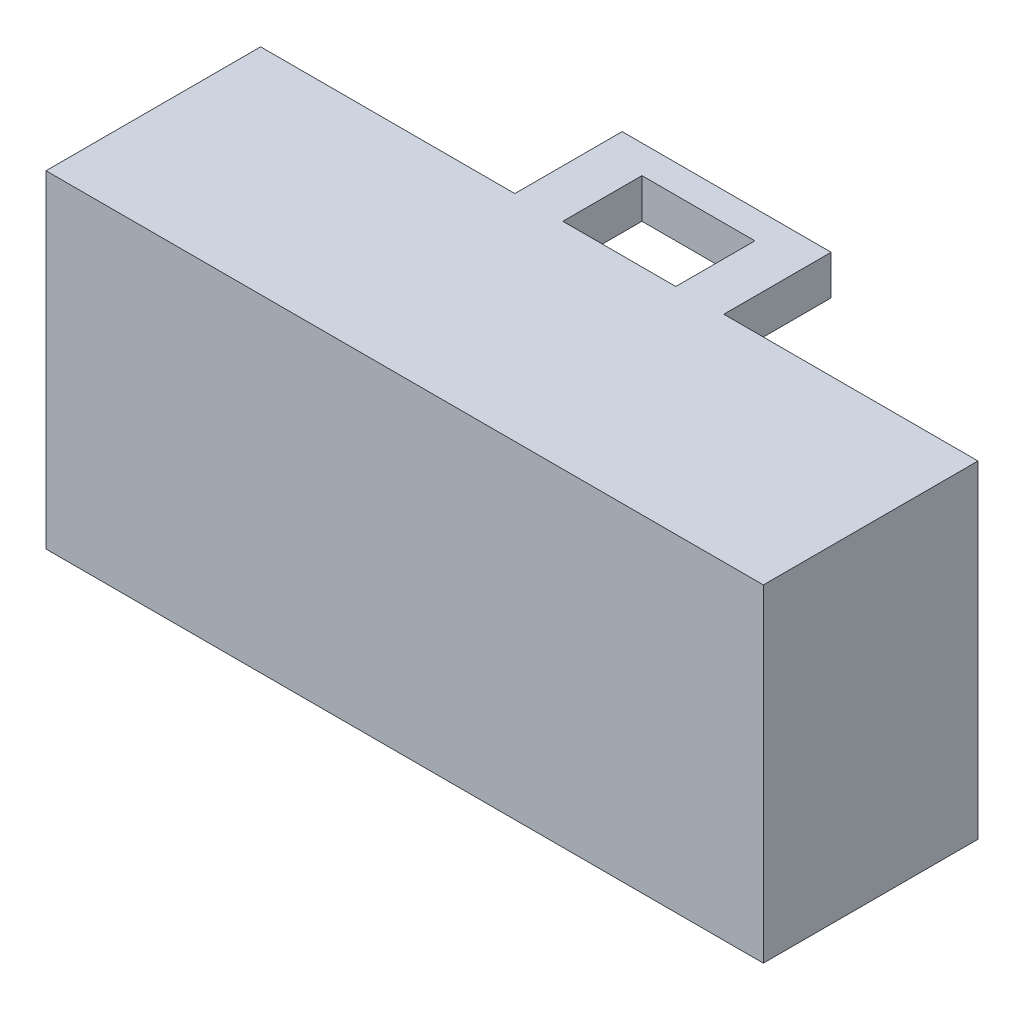
from build123d import *

# Parameters (mm, degrees)
CROQUIS1_W              = 12.7
CROQUIS1_H              = 5.8
SALIENTE_EXTRUIR1_DEPTH = 3.8
CROQUIS2_W              = 3.7
CROQUIS2_H              = 0.7
SALIENTE_EXTRUIR2_DEPTH = 1.9
CROQUIS3_W              = 2
CROQUIS3_H              = 1.4
CORTAR_EXTRUIR1_DEPTH   = 2.95


with BuildPart() as part:
    # Croquis1 → Saliente-Extruir1 (new body)
    with BuildSketch(Plane.XY):
        Rectangle(CROQUIS1_W, CROQUIS1_H)
    extrude(amount=SALIENTE_EXTRUIR1_DEPTH)

    # Croquis2 → Saliente-Extruir2 (add)
    with BuildSketch(Plane.XY):
        with Locations((0, 2.55)):
            Rectangle(CROQUIS2_W, CROQUIS2_H)
        with Locations((0, -2.55)):
            Rectangle(CROQUIS2_W, CROQUIS2_H)
    extrude(amount=-SALIENTE_EXTRUIR2_DEPTH)

    # Croquis3 → Cortar-Extruir1 (cut, symmetric)
    with BuildSketch(Plane(origin=(0, 0, 0), x_dir=(1, 0, 0), z_dir=(0, 1, 0))):
        with Locations((0, 0.7)):
            Rectangle(CROQUIS3_W, CROQUIS3_H)
    extrude(amount=CORTAR_EXTRUIR1_DEPTH, both=True, mode=Mode.SUBTRACT)


solid = part.part
